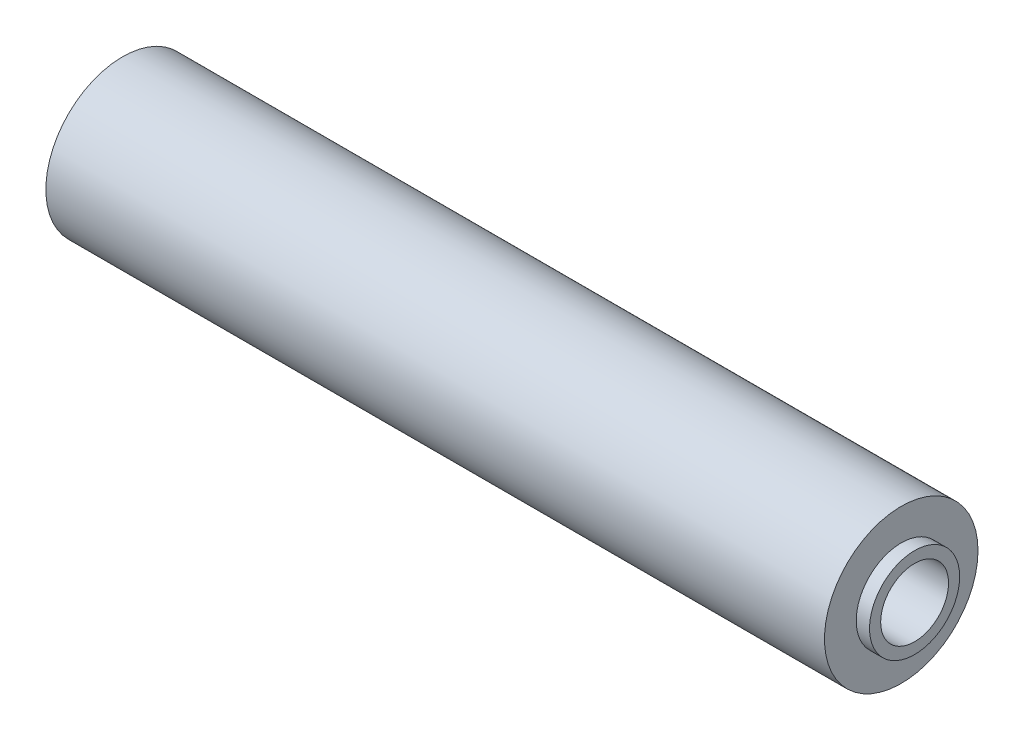
from build123d import *

# Parameters (mm, degrees)
CUT_EXTRUDE2_REACH = 59.435
SKETCH4_W          = 5
SKETCH4_H          = 5.1
FILLET1_R          = 0.5
SKETCH13_R         = 3.05
CUT_EXTRUDE3_DEPTH = 114.619804612


with BuildPart() as part:
    # Sketch2 → Revolve2 (revolve)
    with BuildSketch(Plane.XY):
        Polygon((-56.6, 0), (56.6, 0), (56.6, 2.55), (36.2, 2.55), (36.2, 4.05), (35, 4.05), (35, 6.9), (30, 6.9), (-30, 6.9), (-35, 6.9), (-35, 4.05), (-36.2, 4.05), (-36.2, 2.55), (-56.6, 2.55), align=None)
    revolve(axis=Axis((62.26, 0, 0), (-1, 0, 0)))

    # Sketch4 → Cut-Extrude2 (cut, up to next)
    with BuildSketch(Plane(origin=(0, 0, 0), x_dir=(1, 0, 0), z_dir=(0, 1, 0)), mode=Mode.PRIVATE) as cut_extrude2_sk1:
        with Locations((-54.1, 0)):
            Rectangle(SKETCH4_W, SKETCH4_H)
    cut_extrude2_tool1 = extrude(cut_extrude2_sk1.sketch, amount=CUT_EXTRUDE2_REACH, mode=Mode.PRIVATE) & part.part
    add(cut_extrude2_tool1.solids().sort_by_distance((-54.1, 0, 0))[0], mode=Mode.SUBTRACT)

    # Fillet1
    fillet1_edges = [part.edges().sort_by_distance(p)[0] for p in [
        (36.2, -2.55, 0),
        (-36.2, -2.55, 0),
    ]]
    fillet(fillet1_edges, radius=FILLET1_R)

    # Sketch13 → Cut-Extrude3 (cut, through all)
    with BuildSketch(Plane.ZY.offset(56.6)):
        Circle(SKETCH13_R)
    extrude(amount=-CUT_EXTRUDE3_DEPTH, mode=Mode.SUBTRACT)


solid = part.part
